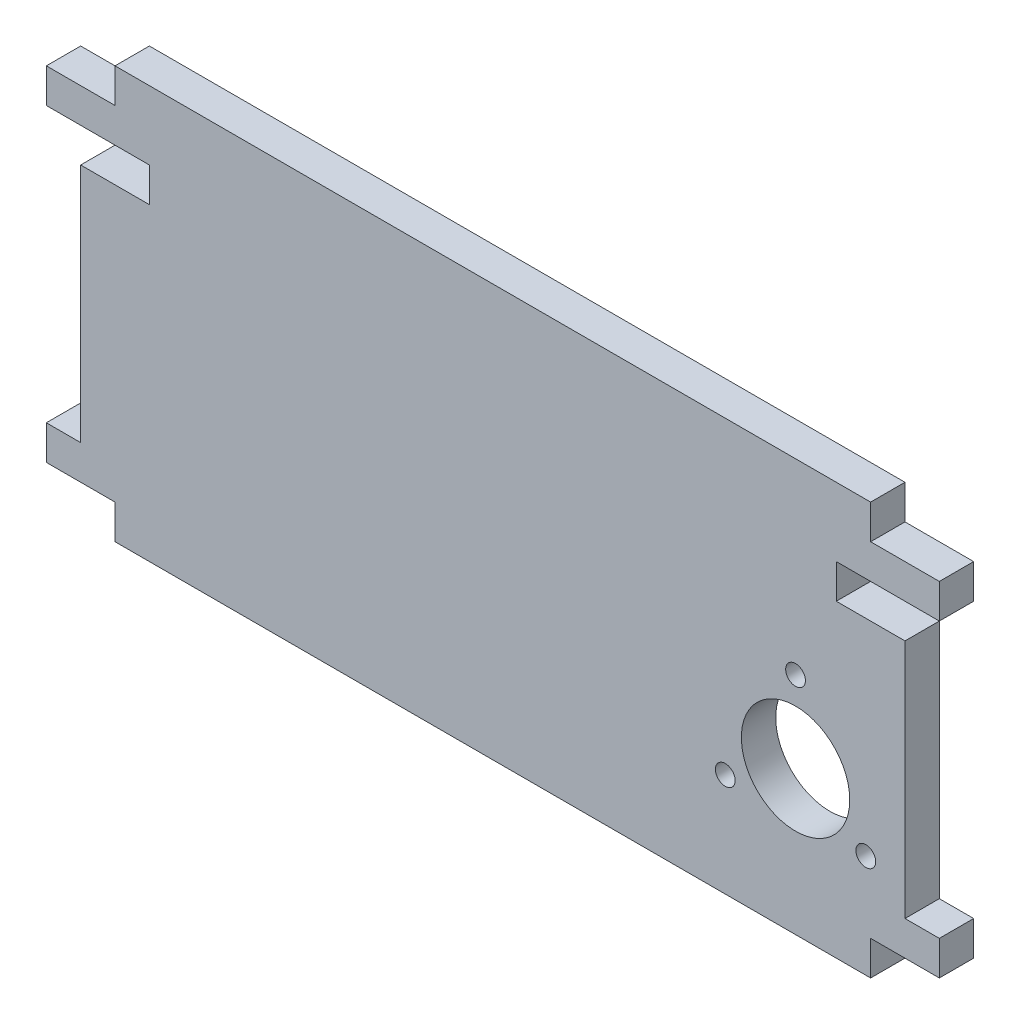
from build123d import *

# Parameters (mm, degrees)
BOSS_EXTRUDE1_DEPTH = 6.35
SKETCH2_R           = 10.0203
SKETCH2_R_2         = 1.8288
SKETCH2_W           = 19.05
SKETCH2_H           = 6.35
CUT_EXTRUDE1_DEPTH  = 131.484388434


with BuildPart() as part:
    # Sketch1 → Boss-Extrude1 (new body)
    with BuildSketch(Plane.XY):
        Polygon((-95.25, -3.175), (44.45, -3.175), (44.45, 3.175), (57.15, 3.175), (57.15, 9.525), (50.8, 9.525), (50.8, 60.325), (57.15, 60.325), (57.15, 66.675), (44.45, 66.675), (44.45, 73.025), (-95.25, 73.025), (-95.25, 66.675), (-107.95, 66.675), (-107.95, 60.325), (-101.6, 60.325), (-101.6, 9.525), (-107.95, 9.525), (-107.95, 3.175), (-95.25, 3.175), align=None)
    extrude(amount=BOSS_EXTRUDE1_DEPTH)

    # Sketch2 → Cut-Extrude1 (cut, through all)
    with BuildSketch(Plane.XY.offset(6.35)):
        with Locations((30.5689, 23.4061)):
            Circle(SKETCH2_R)
        with Locations((30.5689, 38.4061)):
            Circle(SKETCH2_R_2)
        with Locations((17.578518943, 15.9061)):
            Circle(SKETCH2_R_2)
        with Locations((43.559281057, 15.9061)):
            Circle(SKETCH2_R_2)
        with Locations((47.625, 57.15)):
            Rectangle(SKETCH2_W, SKETCH2_H)
        with Locations((-98.425, 57.15)):
            Rectangle(SKETCH2_W, SKETCH2_H)
    extrude(amount=-CUT_EXTRUDE1_DEPTH, mode=Mode.SUBTRACT)


solid = part.part
